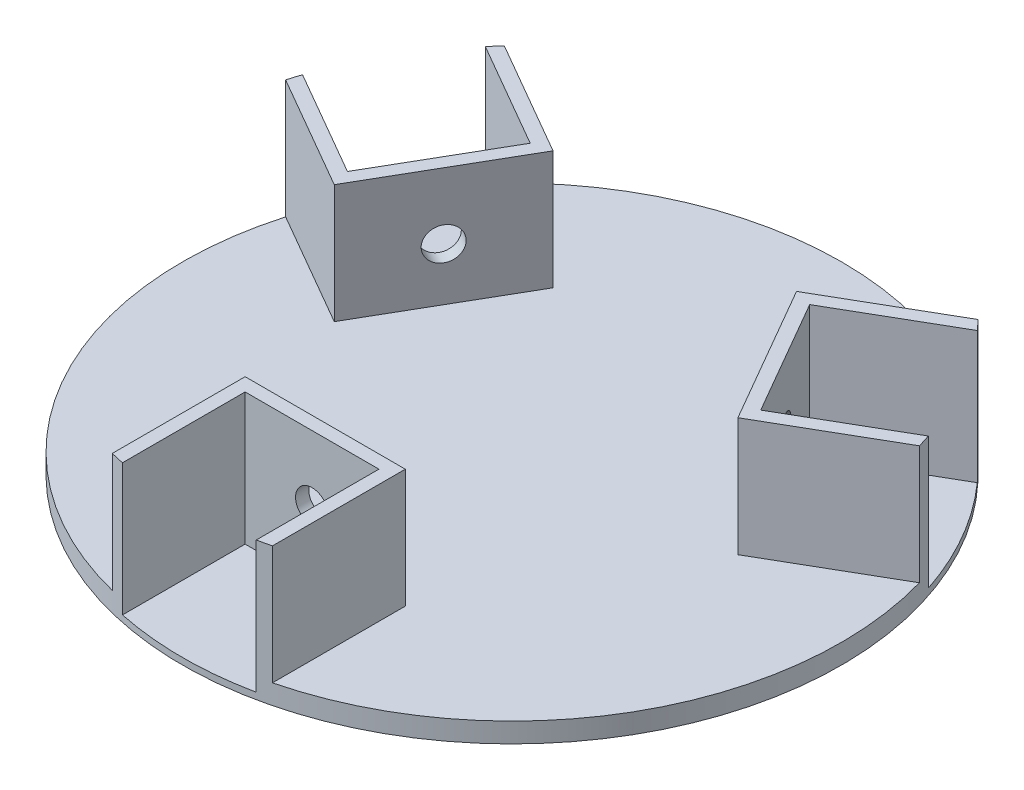
from build123d import *

# Parameters (mm, degrees)
BOSS_EXTRUDE1_DEPTH = 20
SHELL1_T            = -2
BOSS_EXTRUDE2_START = 1
SKETCH2_R           = 50
BOSS_EXTRUDE2_DEPTH = 1
SKETCH3_R           = 2.5
CUT_EXTRUDE1_DEPTH  = 96.067235106
CIRPATTERN1_COUNT   = 3


with BuildPart() as part:
    # Sketch1 → Boss-Extrude1 (new body)
    with BuildSketch(Plane(origin=(0, 0, 0), x_dir=(1, 0, 0), z_dir=(0, 1, 0))):
        with BuildLine():
            Line((-31.353657468, -234.344603511), (-21.203657468, -216.764287814))
            Line((-21.203657468, -216.764287814), (-37.324683077, -207.456809339))
            ThreePointArc((-37.324683077, -207.456809339), (0, -190.726435625), (37.324683077, -207.456809339))
            Line((37.324683077, -207.456809339), (21.203657468, -216.764287814))
            Line((21.203657468, -216.764287814), (31.353657468, -234.344603511))
            Line((31.353657468, -234.344603511), (47.474683077, -225.037125036))
            ThreePointArc((47.474683077, -225.037125036), (43.301270189, -265.726435625), (10.15, -289.685372501))
            Line((10.15, -289.685372501), (10.15, -271.070415552))
            Line((10.15, -271.070415552), (-10.15, -271.070415552))
            Line((-10.15, -271.070415552), (-10.15, -289.685372501))
            ThreePointArc((-10.15, -289.685372501), (-43.301270189, -265.726435625), (-47.474683077, -225.037125036))
            Line((-47.474683077, -225.037125036), (-31.353657468, -234.344603511))
        make_face()
    extrude(amount=BOSS_EXTRUDE1_DEPTH)

    # Shell1
    shell1_openings = [part.faces().sort_by_distance(p)[0] for p in [
        (0, 20, 240.726435625),
        (0, 10, 190.726435625),
        (43.301270189, 10, 265.726435625),
        (-43.301270189, 10, 265.726435625),
    ]]
    offset(amount=SHELL1_T, openings=shell1_openings, kind=Kind.INTERSECTION)

    # Sketch2 → Boss-Extrude2 (add)
    with BuildSketch(Plane.XZ.offset(BOSS_EXTRUDE2_START)):
        with Locations(Location((0, 240.726435625, 0), (0, 0, 270))):
            Circle(SKETCH2_R)
    extrude(amount=-BOSS_EXTRUDE2_DEPTH)

    # Sketch3 → Cut-Extrude1 (cut, through all)
    with BuildSketch(Plane(origin=(0, 0, 269.070415552), x_dir=(-1, 0, 0), z_dir=(0, 0, -1))):
        with Locations((0, 10)):
            Circle(SKETCH3_R)
    cut_extrude1 = extrude(amount=-CUT_EXTRUDE1_DEPTH, mode=Mode.SUBTRACT)

    # CirPattern1: Cut-Extrude1 ×3 about axis
    cirpattern1_axis = Axis((0, 0, 240.726435625), (0, -1, 0))
    for i in range(1, CIRPATTERN1_COUNT):
        add(cut_extrude1.rotate(cirpattern1_axis, i * 360 / CIRPATTERN1_COUNT), mode=Mode.SUBTRACT)


solid = part.part
